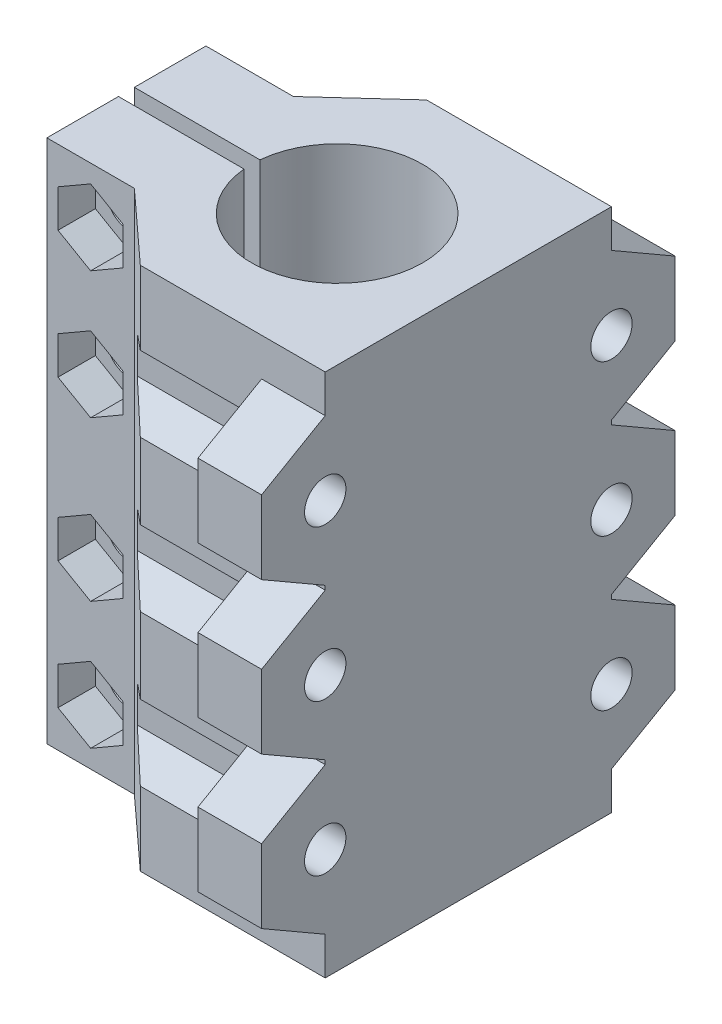
from build123d import *

# Parameters (mm, degrees)
EXTRUDE_5_DEPTH      = 66
CUT_EXTRUDE_1_DEPTH  = 83.95179323
SKETCH_6_4_R         = 2.5
CUT_EXTRUDE_3_DEPTH  = 83.95179323
CUT_EXTRUDE_5_DEPTH  = 83.95179323
EXTRUDE_9_DEPTH      = 4
SKETCH_16_R          = 2.5
CUT_EXTRUDE_6_DEPTH  = 81.950602221
SKETCH_21_R          = 2.5
CUT_EXTRUDE_9_DEPTH  = 79.193669821
CUT_EXTRUDE_10_DEPTH = 4.7
EXTRUDE_START        = -9
SKETCH_26_R          = 2.5
EXTRUDE_11_DEPTH     = 9
SKETCH_27_R          = 2.5
EXTRUDE_12_DEPTH     = 9
SKETCH_25_R          = 1.5
CUT_EXTRUDE_12_DEPTH = 10
SKETCH_30_W          = 2.5
SKETCH_30_H          = 5.5
CUT_EXTRUDE_13_DEPTH = 8
SKETCH_31_R          = 2.6
CUT_EXTRUDE_14_DEPTH = 83.95179323
CUT_EXTRUDE_15_DEPTH = 39
SKETCH_33_R          = 2.6
CUT_EXTRUDE_16_DEPTH = 79.193669821
CUT_EXTRUDE_17_DEPTH = 4.7
SKETCH_35_R          = 10.75
CUT_EXTRUDE_18_DEPTH = 75.123208241
SKETCH_36_W          = 3.5
SKETCH_36_H          = 7
SKETCH_36_W_2        = 2.5
SKETCH_36_H_2        = 5.5
CUT_EXTRUDE_19_DEPTH = 7.5
SKETCH_37_R          = 1.7
CUT_EXTRUDE_20_DEPTH = 14


with BuildPart() as part:
    # Эскиз1 → Бобышка-Вытянуть5 (new body)
    with BuildSketch(Plane(origin=(0, 0, 0), x_dir=(1, 0, 0), z_dir=(0, 1, 0))):
        with BuildLine():
            Line((-21.5, 10), (-21.5, 1))
            Line((-21.5, 1), (-5.45227248, 1))
            ThreePointArc((-5.45227248, 1), (15.5, 0), (-5.45227248, -1))
            Line((-5.45227248, -1), (-21.5, -1))
            Line((-21.5, -1), (-21.5, -10))
            Line((-21.5, -10), (-10.5, -10))
            Line((-10.5, -10), (-1.750859731, -18))
            Line((-1.750859731, -18), (13.5, -18))
            Line((13.5, -18), (13.5, -26))
            Line((13.5, -26), (21.5, -26))
            Line((21.5, -26), (21.5, -18))
            Line((21.5, -18), (21.5, 18))
            Line((21.5, 18), (21.5, 26))
            Line((21.5, 26), (13.5, 26))
            Line((13.5, 26), (13.5, 18))
            Line((13.5, 18), (-1.750859731, 18))
            Line((-1.750859731, 18), (-10.5, 10))
            Line((-10.5, 10), (-21.5, 10))
        make_face()
    extrude(amount=EXTRUDE_5_DEPTH)

    # Эскиз6 → Вырез-Вытянуть1 (cut, through all)
    with BuildSketch(Plane(origin=(21.5, 0, 0), x_dir=(0, 0, -1), z_dir=(1, 0, 0))):
        Polygon((-18, 61.237604307), (-18, 66), (-26, 66), (-26, 56.618802154), align=None)
        Polygon((-18, 42.762395693), (-26, 47.381197846), (-26, 37.618802154), (-18, 42.237604307), align=None)
        Polygon((-18, 23.762395693), (-26, 28.381197846), (-26, 18.618802154), (-18, 23.237604307), align=None)
        Polygon((-18, 4.762395693), (-26, 9.381197846), (-26, 0.083563763), (-26, 0), (-18, 0), align=None)
        Polygon((26, 0), (26, 9.381197846), (18, 4.762395693), (18, 0), align=None)
        Polygon((26, 18.618802154), (26, 28.381197846), (18, 23.762395693), (18, 23.237604307), align=None)
        Polygon((26, 37.618802154), (26, 47.381197846), (18, 42.762395693), (18, 42.237604307), align=None)
        Polygon((26, 66), (18, 66), (18, 61.237604307), (26, 56.618802154), align=None)
    extrude(amount=-CUT_EXTRUDE_1_DEPTH, mode=Mode.SUBTRACT)

    # Эскиз6<4> → Вырез-Вытянуть3 (cut, through all)
    with BuildSketch(Plane(origin=(21.5, 0, 0), x_dir=(0, 0, -1), z_dir=(1, 0, 0))):
        with Locations((-18, 52)):
            Circle(SKETCH_6_4_R)
        with Locations((-18, 33)):
            Circle(SKETCH_6_4_R)
        with Locations((-18, 14)):
            Circle(SKETCH_6_4_R)
        with Locations((18, 14)):
            Circle(SKETCH_6_4_R)
        with Locations((18, 33)):
            Circle(SKETCH_6_4_R)
        with Locations((18, 52)):
            Circle(SKETCH_6_4_R)
    extrude(amount=-CUT_EXTRUDE_3_DEPTH, mode=Mode.SUBTRACT)

    # Эскиз10 → Вырез-Вытянуть5 (cut, through all)
    with BuildSketch(Plane(origin=(21.5, 0, 0), x_dir=(0, 0, -1), z_dir=(1, 0, 0))):
        Polygon((14, 16.309401077), (14, 11.690598923), (18, 9.381197846), (22, 11.690598923), (22, 16.309401077), (18, 18.618802154), align=None)
        Polygon((14, 35.309401077), (14, 30.690598923), (18, 28.381197846), (22, 30.690598923), (22, 35.309401077), (18, 37.618802154), align=None)
        Polygon((14, 54.309401077), (14, 49.690598923), (18, 47.381197846), (22, 49.690598923), (22, 54.309401077), (18, 56.618802154), align=None)
        Polygon((-18, 56.618802154), (-14, 54.309401077), (-14, 49.690598923), (-18, 47.381197846), (-22, 49.690598923), (-22, 54.309401077), align=None)
        Polygon((-18, 37.618802154), (-14, 35.309401077), (-14, 30.690598923), (-18, 28.381197846), (-22, 30.690598923), (-22, 35.309401077), align=None)
        Polygon((-18, 18.618802154), (-14, 16.309401077), (-14, 11.690598923), (-18, 9.381197846), (-22, 11.690598923), (-22, 16.309401077), align=None)
    extrude(amount=-CUT_EXTRUDE_5_DEPTH, mode=Mode.SUBTRACT)

    # Эскиз12 → Бобышка-Вытянуть9 (add)
    with BuildSketch(Plane(origin=(21.5, 0, 0), x_dir=(0, 0, -1), z_dir=(1, 0, 0))):
        Polygon((-14, 49.690598923), (-14, 54.309401077), (-18, 56.618802154), (-22, 54.309401077), (-22, 49.690598923), (-18, 47.381197846), align=None)
        Polygon((-14, 30.690598923), (-14, 35.309401077), (-18, 37.618802154), (-22, 35.309401077), (-22, 30.690598923), (-18, 28.381197846), align=None)
        Polygon((-14, 11.690598923), (-14, 16.309401077), (-18, 18.618802154), (-22, 16.309401077), (-22, 11.690598923), (-18, 9.381197846), align=None)
        Polygon((22, 49.690598923), (22, 54.309401077), (18, 56.618802154), (14, 54.309401077), (14, 49.690598923), (18, 47.381197846), align=None)
        Polygon((22, 30.690598923), (22, 35.309401077), (18, 37.618802154), (14, 35.309401077), (14, 30.690598923), (18, 28.381197846), align=None)
        Polygon((22, 11.690598923), (22, 16.309401077), (18, 18.618802154), (14, 16.309401077), (14, 11.690598923), (18, 9.381197846), align=None)
    extrude(amount=-EXTRUDE_9_DEPTH)

    # Эскиз16 → Вырез-Вытянуть6 (cut, through all)
    with BuildSketch(Plane.ZY.offset(-17.5)):
        with Locations((-18, 52)):
            Circle(SKETCH_16_R)
        with Locations((-18, 33)):
            Circle(SKETCH_16_R)
        with Locations((-18, 14)):
            Circle(SKETCH_16_R)
        with Locations((18, 14)):
            Circle(SKETCH_16_R)
        with Locations((18, 33)):
            Circle(SKETCH_16_R)
        with Locations((18, 52)):
            Circle(SKETCH_16_R)
    extrude(amount=-CUT_EXTRUDE_6_DEPTH, mode=Mode.SUBTRACT)

    # Эскиз21 → Вырез-Вытянуть9 (cut, through all)
    with BuildSketch(Plane.XY.offset(10)):
        with Locations(Location((-16, 59, 0), (0, 0, 180))):
            Circle(SKETCH_21_R)
        with Locations(Location((-16, 43, 0), (0, 0, 180))):
            Circle(SKETCH_21_R)
        with Locations(Location((-16, 23, 0), (0, 0, 180))):
            Circle(SKETCH_21_R)
        with Locations(Location((-16, 7, 0), (0, 0, 180))):
            Circle(SKETCH_21_R)
        with Locations(Location((-16, 33, 0), (0, 0, 180))):
            Circle(SKETCH_21_R)
    extrude(amount=-CUT_EXTRUDE_9_DEPTH, mode=Mode.SUBTRACT)

    # Эскиз22 → Вырез-Вытянуть10 (cut)
    with BuildSketch(Plane.XY.offset(10)):
        Polygon((-12, 56.690598923), (-12, 61.309401077), (-16, 63.618802154), (-20, 61.309401077), (-20, 56.690598923), (-16, 54.381197846), align=None)
        Polygon((-12, 40.690598923), (-12, 45.309401077), (-16, 47.618802154), (-20, 45.309401077), (-20, 40.690598923), (-16, 38.381197846), align=None)
        Polygon((-16, 27.618802154), (-12, 25.309401077), (-12, 20.690598923), (-16, 18.381197846), (-20, 20.690598923), (-20, 25.309401077), align=None)
        Polygon((-16, 11.618802154), (-12, 9.309401077), (-12, 4.690598923), (-16, 2.381197846), (-20, 4.690598923), (-20, 9.309401077), align=None)
    extrude(amount=-CUT_EXTRUDE_10_DEPTH, mode=Mode.SUBTRACT)

    # Эскиз26 → Бобышка-Вытянуть11 (add)
    with BuildSketch(Plane(origin=(0, 0, -10), x_dir=(-1, 0, 0), z_dir=(0, 0, -1)).offset(EXTRUDE_START)):
        with Locations(Location((16, 33, 0), (0, 0, 180))):
            Circle(SKETCH_26_R)
    extrude(amount=EXTRUDE_11_DEPTH)

    # Эскиз27 → Бобышка-Вытянуть12 (add)
    with BuildSketch(Plane.XY.offset(10)):
        with Locations((-16, 33)):
            Circle(SKETCH_27_R)
    extrude(amount=-EXTRUDE_12_DEPTH)

    # Эскиз25 → Вырез-Вытянуть12 (cut)
    with BuildSketch(Plane.ZY.offset(21.5)):
        with Locations((-5.5, 15)):
            Circle(SKETCH_25_R)
        with Locations((-5.5, 33)):
            Circle(SKETCH_25_R)
    extrude(amount=-CUT_EXTRUDE_12_DEPTH, mode=Mode.SUBTRACT)

    # Эскиз30 → Вырез-Вытянуть13 (cut)
    with BuildSketch(Plane(origin=(0, 0, -10), x_dir=(-1, 0, 0), z_dir=(0, 0, -1))):
        with Locations((16, 33)):
            Rectangle(SKETCH_30_W, SKETCH_30_H)
        with Locations((16, 15)):
            Rectangle(SKETCH_30_W, SKETCH_30_H)
    extrude(amount=-CUT_EXTRUDE_13_DEPTH, mode=Mode.SUBTRACT)

    # Эскиз31 → Вырез-Вытянуть14 (cut, through all)
    with BuildSketch(Plane(origin=(21.5, 0, 0), x_dir=(0, 0, -1), z_dir=(1, 0, 0))):
        with Locations((18, 52)):
            Circle(SKETCH_31_R)
        with Locations((18, 33)):
            Circle(SKETCH_31_R)
        with Locations((18, 14)):
            Circle(SKETCH_31_R)
        with Locations((-18, 14)):
            Circle(SKETCH_31_R)
        with Locations((-18, 33)):
            Circle(SKETCH_31_R)
        with Locations((-18, 52)):
            Circle(SKETCH_31_R)
    extrude(amount=-CUT_EXTRUDE_14_DEPTH, mode=Mode.SUBTRACT)

    # Эскиз32 → Вырез-Вытянуть15 (cut)
    with BuildSketch(Plane.ZY.offset(21.5)):
        Polygon((18, 28.265727793), (22.1, 30.632863896), (22.1, 35.367136104), (18, 37.734272207), (13.9, 35.367136104), (13.9, 30.632863896), align=None)
        Polygon((18, 9.265727793), (22.1, 11.632863896), (22.1, 16.367136104), (18, 18.734272207), (13.9, 16.367136104), (13.9, 11.632863896), align=None)
        Polygon((-18, 9.265727793), (-13.9, 11.632863896), (-13.9, 16.367136104), (-18, 18.734272207), (-22.1, 16.367136104), (-22.1, 11.632863896), align=None)
        Polygon((-18, 28.265727793), (-13.9, 30.632863896), (-13.9, 35.367136104), (-18, 37.734272207), (-22.1, 35.367136104), (-22.1, 30.632863896), align=None)
        Polygon((-18, 47.265727793), (-13.9, 49.632863896), (-13.9, 54.367136104), (-18, 56.734272207), (-22.1, 54.367136104), (-22.1, 49.632863896), align=None)
        Polygon((18, 47.265727793), (22.1, 49.632863896), (22.1, 54.367136104), (18, 56.734272207), (13.9, 54.367136104), (13.9, 49.632863896), align=None)
    extrude(amount=-CUT_EXTRUDE_15_DEPTH, mode=Mode.SUBTRACT)

    # Эскиз33 → Вырез-Вытянуть16 (cut, through all)
    with BuildSketch(Plane.XY.offset(10)):
        with Locations((-16, 59)):
            Circle(SKETCH_33_R)
        with Locations((-16, 43)):
            Circle(SKETCH_33_R)
        with Locations(Location((-16, 23, 0), (0, 0, 180))):
            Circle(SKETCH_33_R)
        with Locations(Location((-16, 7, 0), (0, 0, 180))):
            Circle(SKETCH_33_R)
    extrude(amount=-CUT_EXTRUDE_16_DEPTH, mode=Mode.SUBTRACT)

    # Эскиз34 → Вырез-Вытянуть17 (cut)
    with BuildSketch(Plane.XY.offset(10)):
        Polygon((-16, 54.265727793), (-11.9, 56.632863896), (-11.9, 61.367136104), (-16, 63.734272207), (-20.1, 61.367136104), (-20.1, 56.632863896), align=None)
        Polygon((-16, 38.265727793), (-11.9, 40.632863896), (-11.9, 45.367136104), (-16, 47.734272207), (-20.1, 45.367136104), (-20.1, 40.632863896), align=None)
        Polygon((-16, 18.265727793), (-11.9, 20.632863896), (-11.9, 25.367136104), (-16, 27.734272207), (-20.1, 25.367136104), (-20.1, 20.632863896), align=None)
        Polygon((-16, 2.265727793), (-11.9, 4.632863896), (-11.9, 9.367136104), (-16, 11.734272207), (-20.1, 9.367136104), (-20.1, 4.632863896), align=None)
    extrude(amount=-CUT_EXTRUDE_17_DEPTH, mode=Mode.SUBTRACT)

    # Эскиз35 → Вырез-Вытянуть18 (cut, through all)
    with BuildSketch(Plane.XZ):
        with Locations((5, 0)):
            Circle(SKETCH_35_R)
    extrude(amount=-CUT_EXTRUDE_18_DEPTH, mode=Mode.SUBTRACT)

    # Эскиз36 → Вырез-Вытянуть19 (cut)
    # profile 1 of 3: a face of its own
    with BuildSketch(Plane(origin=(0, 0, -10), x_dir=(-1, 0, 0), z_dir=(0, 0, -1))):
        with Locations((16, 15)):
            Rectangle(SKETCH_36_W, SKETCH_36_H)
        with Locations((16, 15)):
            Rectangle(SKETCH_36_W_2, SKETCH_36_H_2, mode=Mode.SUBTRACT)
    # profile 2 of 3: a face of its own
    with BuildSketch(Plane(origin=(0, 0, -10), x_dir=(-1, 0, 0), z_dir=(0, 0, -1))):
        with Locations((16, 15)):
            Rectangle(SKETCH_36_W_2, SKETCH_36_H_2)
    # profile 3 of 3: a face of its own
    with BuildSketch(Plane(origin=(0, 0, -10), x_dir=(-1, 0, 0), z_dir=(0, 0, -1))):
        with Locations((16, 33)):
            Rectangle(SKETCH_36_W, SKETCH_36_H)
    extrude(amount=-CUT_EXTRUDE_19_DEPTH, mode=Mode.SUBTRACT)

    # Эскиз37 → Вырез-Вытянуть20 (cut)
    with BuildSketch(Plane.ZY.offset(21.5)):
        with Locations((-5.5, 33)):
            Circle(SKETCH_37_R)
        with Locations((-5.5, 15)):
            Circle(SKETCH_37_R)
    extrude(amount=-CUT_EXTRUDE_20_DEPTH, mode=Mode.SUBTRACT)


solid = part.part
